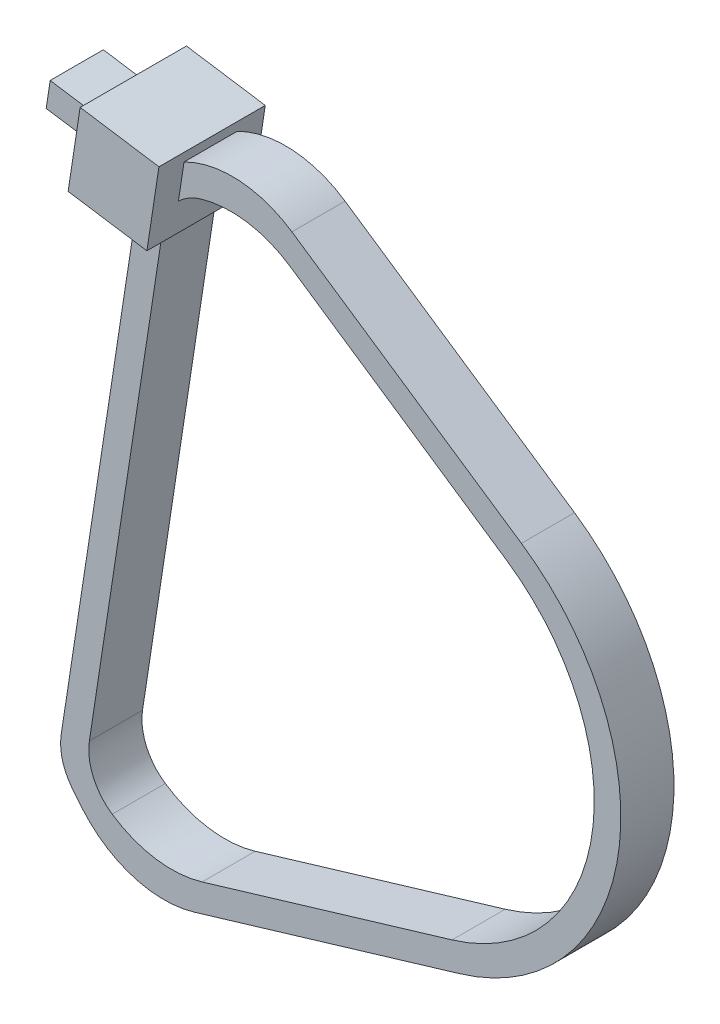
from build123d import *

# Parameters (mm, degrees)
BOSS_EXTRUDE1_START      = -1.25
BOSS_EXTRUDE1_DEPTH      = 2
BOSS_EXTRUDE2_DEPTH      = 1
BOSS_EXTRUDE2_DEPTH_BACK = 3
SKETCH3_W                = 2
SKETCH3_H                = 1
BOSS_EXTRUDE3_DEPTH      = 2


with BuildPart() as part:
    # Sketch1 → Boss-Extrude1 (new body)
    with BuildSketch(Plane.XY.offset(BOSS_EXTRUDE1_START)):
        with BuildLine():
            Line((2.436539132, -8.143296449), (-7.548366257, -11.130859638))
            ThreePointArc((-7.548366257, -11.130859638), (-9.842130636, -11.130694708), (-11.758669759, -9.870443602))
            ThreePointArc((-11.758669759, -9.870443602), (-11.965894787, -9.618177235), (-12.167708806, -9.361561504))
            ThreePointArc((-12.167708806, -9.361561504), (-12.519382992, -8.640760337), (-12.559604102, -7.839753896))
            Line((-12.559604102, -7.839753896), (-9.643676177, 11.234095698))
            ThreePointArc((-9.643676177, 11.234095698), (-9.365976364, 11.986499758), (-8.815011776, 12.569309399))
            ThreePointArc((-8.815011776, 12.569309399), (-8.54574672, 12.753908592), (-8.272617255, 12.932740434))
            ThreePointArc((-8.272617255, 12.932740434), (-6.067091304, 13.562827996), (-3.87804418, 12.877680022))
            Line((-3.87804418, 12.877680022), (4.758214838, 7.043393469))
            ThreePointArc((4.758214838, 7.043393469), (8.402381141, -1.284519818), (2.436539132, -8.143296449))
        make_face()
        with BuildLine():
            Line((-7.257137668, -9.99991839), (2.149887469, -7.185261573))
            ThreePointArc((2.149887469, -7.185261573), (7.413865713, -1.133399839), (4.198424857, 6.214758943))
            Line((4.198424857, 6.214758943), (-3.938007339, 11.711383912))
            ThreePointArc((-3.938007339, 11.711383912), (-5.571798261, 12.3507715), (-7.322050422, 12.229500574))
            ThreePointArc((-7.322050422, 12.229500574), (-8.258340754, 11.626081421), (-8.726639699, 10.615413149))
            Line((-8.726639699, 10.615413149), (-11.499609723, -7.523311304))
            ThreePointArc((-11.499609723, -7.523311304), (-11.354656305, -8.627730955), (-10.641413415, -9.483323638))
            ThreePointArc((-10.641413415, -9.483323638), (-9.007335115, -10.12197642), (-7.257137668, -9.99991839))
        make_face(mode=Mode.SUBTRACT)
    extrude(amount=BOSS_EXTRUDE1_DEPTH)

    # Sketch2 → Boss-Extrude2 (add, two sides: drawn at the far end of the back side and taken through both)
    with BuildSketch(Plane.XY.offset(0.75).offset(-BOSS_EXTRUDE2_DEPTH_BACK)):
        Polygon((-8.334933677, 10.530761514), (-11.300479962, 10.98412145), (-10.847120026, 13.949667735), (-7.881573741, 13.4963078), align=None)
    extrude(amount=BOSS_EXTRUDE2_DEPTH + BOSS_EXTRUDE2_DEPTH_BACK)

    # Sketch3 → Boss-Extrude3 (add)
    with BuildSketch(Plane(origin=(-12.683264825, 1.938962867, 0), x_dir=(0, 0, 1), z_dir=(-0.9885154283423572, 0.15111997859027873, 0))):
        with Locations((-0.25, 10.65024523)):
            Rectangle(SKETCH3_W, SKETCH3_H)
    extrude(amount=BOSS_EXTRUDE3_DEPTH)


solid = part.part
